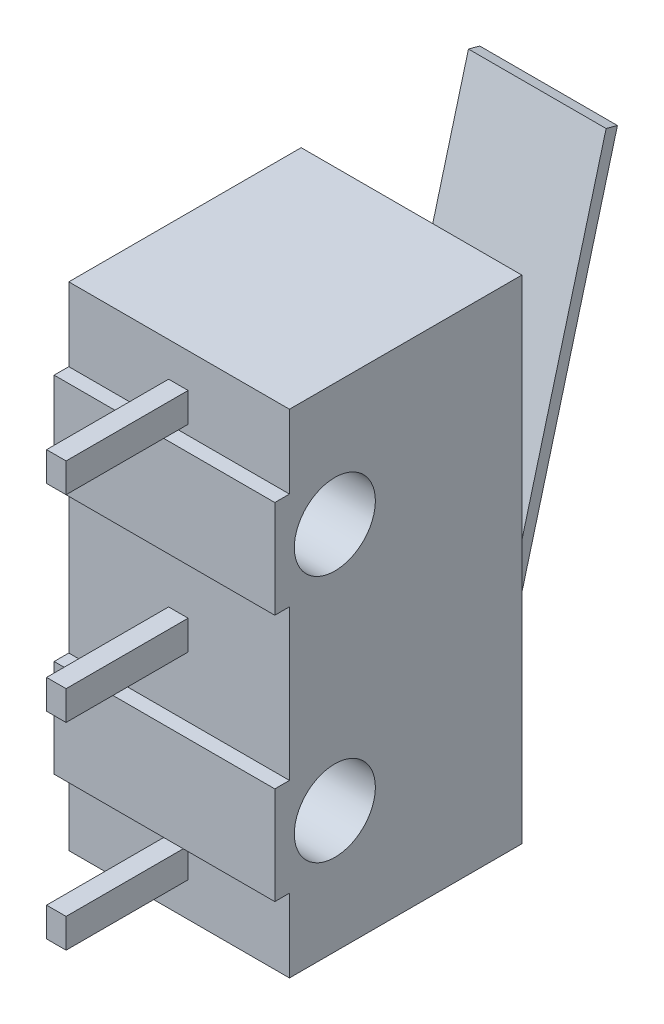
from build123d import *

# Parameters (mm, degrees)
SKETCH2_W           = 5.7404
SKETCH2_H           = 12.8143
OG_BOX_DEPTH        = 6.0452
SKETCH4_W           = 0.508
SKETCH4_H           = 0.762
PINS_DEPTH          = 3.175
CLICKER_DEPTH       = 3.5814
SKETCH8_W           = 5.7404
SKETCH8_H           = 2.54
BOSS_EXTRUDE3_DEPTH = 0.381
SKETCH9_R           = 1.0541
CUT_EXTRUDE1_DEPTH  = 8.89


with BuildPart() as part:
    # Sketch2 → OG box (new body)
    with BuildSketch(Plane.XY):
        with Locations((0.019740217, -4.616841123)):
            Rectangle(SKETCH2_W, SKETCH2_H)
    extrude(amount=OG_BOX_DEPTH)

    # Sketch4 → Pins (add)
    with BuildSketch(Plane.XY.offset(6.0452)):
        with Locations((0, -4.616841123)):
            Rectangle(SKETCH4_W, SKETCH4_H)
        with Locations((0, 0.513958877)):
            Rectangle(SKETCH4_W, SKETCH4_H)
        with Locations((0, -9.747641123)):
            Rectangle(SKETCH4_W, SKETCH4_H)
    extrude(amount=PINS_DEPTH)

    # Sketch6 → Clicker (add)
    with BuildSketch(Plane.ZY.offset(1.7907)):
        Polygon((0, -10.56854726), (-3.5867143, 2.81725274), (-3.292300108, 2.896140785), (-2.938516926, 1.575803975), (0, -9.390890493), align=None)
    extrude(amount=-CLICKER_DEPTH)

    # Sketch8 → Boss-Extrude3 (add)
    with BuildSketch(Plane.XY.offset(6.0452)):
        with Locations((0.019740217, -1.391041123)):
            Rectangle(SKETCH8_W, SKETCH8_H)
        with Locations((0.019740217, -7.842641123)):
            Rectangle(SKETCH8_W, SKETCH8_H)
    extrude(amount=BOSS_EXTRUDE3_DEPTH)

    # Sketch9 → Cut-Extrude1 (cut)
    with BuildSketch(Plane(origin=(2.889940217, 0, 0), x_dir=(0, 0, -1), z_dir=(1, 0, 0))):
        with Locations(Location((-4.8641, -1.391041123, 0), (0, 0, 90))):
            Circle(SKETCH9_R)
        with Locations(Location((-4.8641, -7.842641123, 0), (0, 0, 90))):
            Circle(SKETCH9_R)
    extrude(amount=-CUT_EXTRUDE1_DEPTH, mode=Mode.SUBTRACT)


solid = part.part
